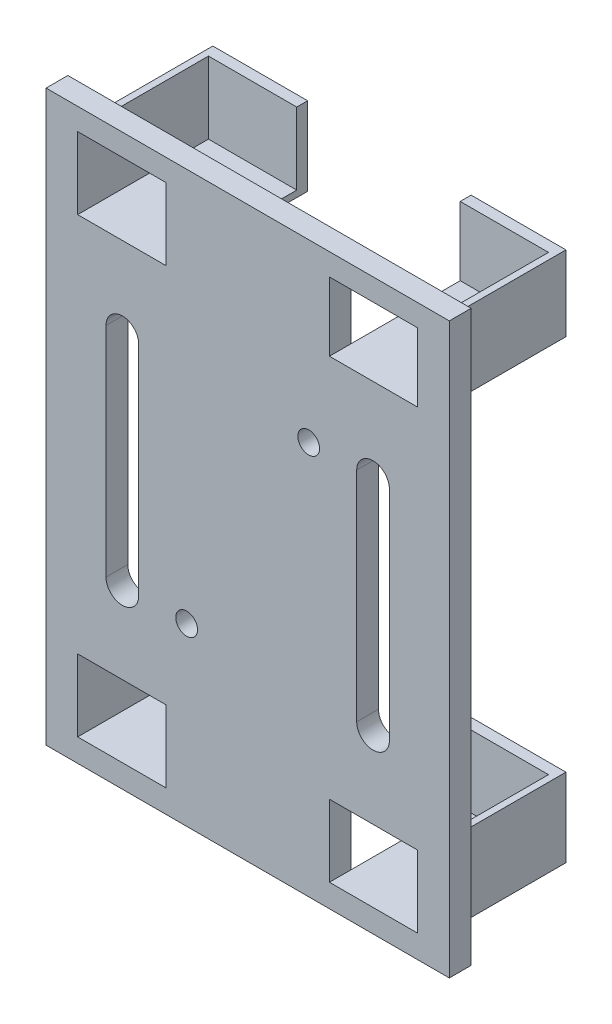
from build123d import *

# Parameters (mm, degrees)
SKETCH1_W           = 93.98
SKETCH1_H           = 132.62918919
SKETCH1_R           = 2.54
SKETCH1_W_2         = 20.574
SKETCH1_H_2         = 16.002
SKETCH1_H_3         = 16.764
BOSS_EXTRUDE1_DEPTH = 5.08
BOSS_EXTRUDE2_DEPTH = 27.94
SKETCH4_W           = 22.098
SKETCH4_H           = 17.526
SKETCH4_H_2         = 18.288
BOSS_EXTRUDE3_DEPTH = 2.54


with BuildPart() as part:
    # Sketch1 → Boss-Extrude1 (new body)
    with BuildSketch(Plane.XY):
        Rectangle(SKETCH1_W, SKETCH1_H)
        with Locations((-14.224, -25.4)):
            Circle(SKETCH1_R, mode=Mode.SUBTRACT)
        with Locations((14.224, 25.4)):
            Circle(SKETCH1_R, mode=Mode.SUBTRACT)
        with Locations((29.337, 53.213)):
            Rectangle(SKETCH1_W_2, SKETCH1_H_2, mode=Mode.SUBTRACT)
        with Locations((-29.337, -52.578)):
            Rectangle(SKETCH1_W_2, SKETCH1_H_3, mode=Mode.SUBTRACT)
        with Locations((-29.337, 52.832)):
            Rectangle(SKETCH1_W_2, SKETCH1_H_3, mode=Mode.SUBTRACT)
        with Locations((29.337, -52.578)):
            Rectangle(SKETCH1_W_2, SKETCH1_H_3, mode=Mode.SUBTRACT)
        with BuildLine():
            Line((-33.02, -25.4), (-33.02, 25.4))
            ThreePointArc((-33.02, 25.4), (-29.21, 29.21), (-25.4, 25.4))
            Line((-25.4, 25.4), (-25.4, -25.4))
            ThreePointArc((-25.4, -25.4), (-29.21, -29.21), (-33.02, -25.4))
        make_face(mode=Mode.SUBTRACT)
        with BuildLine():
            Line((25.4, -25.4), (25.4, 25.4))
            ThreePointArc((25.4, 25.4), (29.21, 29.21), (33.02, 25.4))
            Line((33.02, 25.4), (33.02, -25.4))
            ThreePointArc((33.02, -25.4), (29.21, -29.21), (25.4, -25.4))
        make_face(mode=Mode.SUBTRACT)
    extrude(amount=BOSS_EXTRUDE1_DEPTH)

    # Sketch3 → Boss-Extrude2 (add)
    with BuildSketch(Plane(origin=(0, 0, 0), x_dir=(-1, 0, 0), z_dir=(0, 0, -1))):
        Polygon((-19.05, 45.212), (-39.624, 45.212), (-39.624, 61.214), (-41.148, 61.214), (-41.148, 43.688), (-19.05, 43.688), align=None)
        Polygon((19.05, 44.45), (39.624, 44.45), (39.624, 61.214), (41.148, 61.214), (41.148, 42.926), (19.05, 42.926), align=None)
        Polygon((19.05, -60.96), (39.624, -60.96), (39.624, -44.196), (41.148, -44.196), (41.148, -62.484), (19.05, -62.484), align=None)
        Polygon((-39.624, -44.196), (-39.624, -60.96), (-19.05, -60.96), (-19.05, -62.484), (-41.148, -62.484), (-41.148, -44.196), align=None)
    extrude(amount=BOSS_EXTRUDE2_DEPTH)

    # Sketch4 → Boss-Extrude3 (add)
    with BuildSketch(Plane(origin=(0, 0, -27.94), x_dir=(-1, 0, 0), z_dir=(0, 0, -1))):
        with Locations((-30.099, 52.451)):
            Rectangle(SKETCH4_W, SKETCH4_H)
        with Locations((30.099, 52.07)):
            Rectangle(SKETCH4_W, SKETCH4_H_2)
        with Locations((30.099, -53.34)):
            Rectangle(SKETCH4_W, SKETCH4_H_2)
        with Locations((-30.099, -53.34)):
            Rectangle(SKETCH4_W, SKETCH4_H_2)
    extrude(amount=-BOSS_EXTRUDE3_DEPTH)


solid = part.part
